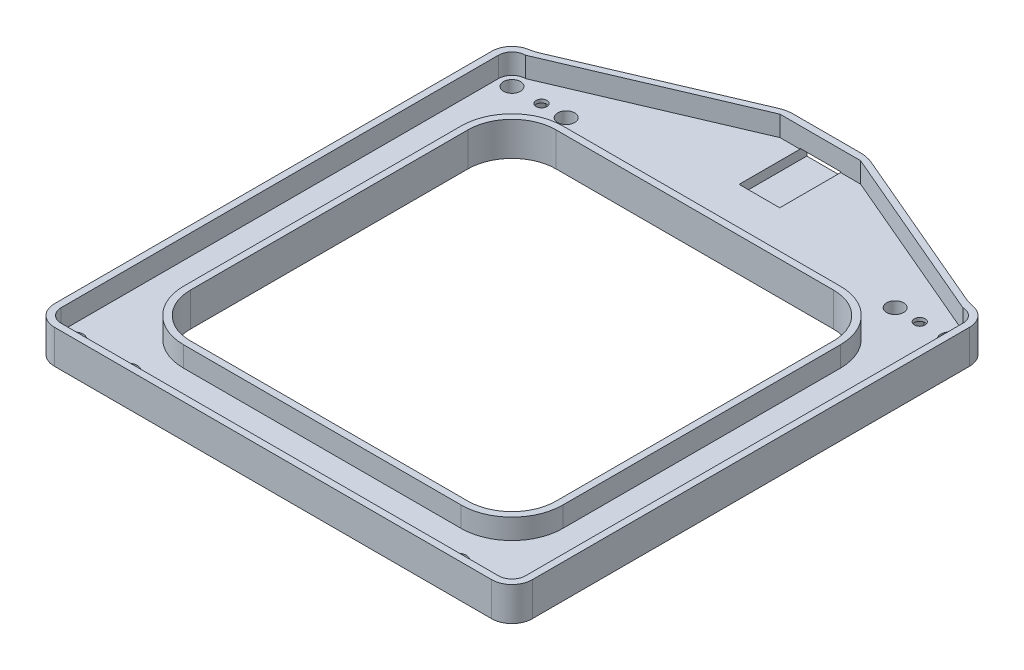
from build123d import *

# Parameters (mm, degrees)
BOSS_EXTRUDE1_DEPTH = 10
CUT_EXTRUDE1_DEPTH  = 6
SKETCH3_R           = 2.5
SKETCH3_R_2         = 1.6
CUT_EXTRUDE5_DEPTH  = 118.268793803
CUT_EXTRUDE6_DEPTH  = 3
FILLET1_R           = 10
SKETCH7_W           = 12
SKETCH7_H           = 3
CUT_EXTRUDE7_DEPTH  = 20


with BuildPart() as part:
    # Sketch1 → Boss-Extrude1 (new body)
    with BuildSketch(Plane(origin=(0, 0, 0), x_dir=(1, 0, 0), z_dir=(0, 1, 0))):
        with BuildLine():
            Line((-64.6, 70.6), (-13.781138102, 92.296857547))
            ThreePointArc((-13.781138102, 92.296857547), (-11.858510235, 92.897157125), (-9.854586018, 93.1))
            Line((-9.854586018, 93.1), (9.854586018, 93.1))
            ThreePointArc((9.854586018, 93.1), (11.858510235, 92.897157125), (13.781138102, 92.296857547))
            Line((13.781138102, 92.296857547), (64.6, 70.6))
            ThreePointArc((64.6, 70.6), (68.842640687, 68.842640687), (70.6, 64.6))
            Line((70.6, 64.6), (70.6, -64.6))
            ThreePointArc((70.6, -64.6), (68.842640687, -68.842640687), (64.6, -70.6))
            Line((64.6, -70.6), (-64.6, -70.6))
            ThreePointArc((-64.6, -70.6), (-68.842640687, -68.842640687), (-70.6, -64.6))
            Line((-70.6, -64.6), (-70.6, 64.6))
            ThreePointArc((-70.6, 64.6), (-68.842640687, 68.842640687), (-64.6, 70.6))
        make_face()
        with BuildLine():
            Line((-41, -54), (41, -54))
            ThreePointArc((41, -54), (50.192388155, -50.192388155), (54, -41))
            Line((54, -41), (54, 41))
            ThreePointArc((54, 41), (50.192388155, 50.192388155), (41, 54))
            Line((41, 54), (-41, 54))
            ThreePointArc((-41, 54), (-50.192388155, 50.192388155), (-54, 41))
            Line((-54, 41), (-54, -41))
            ThreePointArc((-54, -41), (-50.192388155, -50.192388155), (-41, -54))
        make_face(mode=Mode.SUBTRACT)
    extrude(amount=BOSS_EXTRUDE1_DEPTH)

    # Sketch2 → Cut-Extrude1 (cut)
    with BuildSketch(Plane(origin=(0, 10, 0), x_dir=(1, 0, 0), z_dir=(0, 1, 0))):
        with BuildLine():
            Line((-64.6, 68.6), (-11.9, 91.1))
            Line((-11.9, 91.1), (11.9, 91.1))
            Line((11.9, 91.1), (64.6, 68.6))
            ThreePointArc((64.6, 68.6), (67.428427125, 67.428427125), (68.6, 64.6))
            Line((68.6, 64.6), (68.6, -64.6))
            ThreePointArc((68.6, -64.6), (67.428427125, -67.428427125), (64.6, -68.6))
            Line((64.6, -68.6), (-64.6, -68.6))
            ThreePointArc((-64.6, -68.6), (-67.428427125, -67.428427125), (-68.6, -64.6))
            Line((-68.6, -64.6), (-68.6, 64.6))
            ThreePointArc((-68.6, 64.6), (-67.428427125, 67.428427125), (-64.6, 68.6))
        make_face()
        with BuildLine():
            Line((-41, -56), (41, -56))
            ThreePointArc((41, -56), (51.606601718, -51.606601718), (56, -41))
            Line((56, -41), (56, 41))
            ThreePointArc((56, 41), (51.606601718, 51.606601718), (41, 56))
            Line((41, 56), (-41, 56))
            ThreePointArc((-41, 56), (-51.606601718, 51.606601718), (-56, 41))
            Line((-56, 41), (-56, -41))
            ThreePointArc((-56, -41), (-51.606601718, -51.606601718), (-41, -56))
        make_face(mode=Mode.SUBTRACT)
    extrude(amount=-CUT_EXTRUDE1_DEPTH, mode=Mode.SUBTRACT)

    # Sketch3 → Cut-Extrude5 (cut, through all)
    with BuildSketch(Plane(origin=(0, 0, 0), x_dir=(1, 0, 0), z_dir=(0, 1, 0))):
        with Locations(Location((-64.6, 64.6, 0), (0, 0, 270))):
            Circle(SKETCH3_R)
        with Locations(Location((-48.6, 64.6, 0), (0, 0, 270))):
            Circle(SKETCH3_R)
        with Locations(Location((-55.87, 64.6, 0), (0, 0, 270))):
            Circle(SKETCH3_R_2)
        with Locations(Location((55.87, 64.6, 0), (0, 0, 90))):
            Circle(SKETCH3_R_2)
        with Locations(Location((48.6, 64.6, 0), (0, 0, 90))):
            Circle(SKETCH3_R)
        with Locations(Location((64.6, 64.6, 0), (0, 0, 90))):
            Circle(SKETCH3_R)
        with Locations(Location((64.6, -64.6, 0), (0, 0, 270))):
            Circle(SKETCH3_R)
        with Locations(Location((48.6, -64.6, 0), (0, 0, 270))):
            Circle(SKETCH3_R)
        with Locations(Location((55.87, -64.6, 0), (0, 0, 270))):
            Circle(SKETCH3_R_2)
        with Locations(Location((-55.87, -64.6, 0), (0, 0, 90))):
            Circle(SKETCH3_R_2)
        with Locations(Location((-48.6, -64.6, 0), (0, 0, 90))):
            Circle(SKETCH3_R)
        with Locations(Location((-64.6, -64.6, 0), (0, 0, 90))):
            Circle(SKETCH3_R)
    extrude(amount=CUT_EXTRUDE5_DEPTH, mode=Mode.SUBTRACT)

    # Sketch6 → Cut-Extrude6 (cut)
    with BuildSketch(Plane.XZ):
        Polygon((-52.405898385, 64.6), (-54.137949192, 67.6), (-57.602050808, 67.6), (-59.334101615, 64.6), (-57.602050808, 61.6), (-54.137949192, 61.6), align=None)
        Polygon((-54.137949192, -61.6), (-52.405898385, -64.6), (-54.137949192, -67.6), (-57.602050808, -67.6), (-59.334101615, -64.6), (-57.602050808, -61.6), align=None)
        Polygon((52.405898385, -64.6), (54.137949192, -67.6), (57.602050808, -67.6), (59.334101615, -64.6), (57.602050808, -61.6), (54.137949192, -61.6), align=None)
        Polygon((54.137949192, 61.6), (52.405898385, 64.6), (54.137949192, 67.6), (57.602050808, 67.6), (59.334101615, 64.6), (57.602050808, 61.6), align=None)
    extrude(amount=-CUT_EXTRUDE6_DEPTH, mode=Mode.SUBTRACT)

    # Fillet1
    fillet1_edges = [part.edges().sort_by_distance(p)[0] for p in [
        (-64.6, 5, -70.6),
        (64.6, 5, -70.6),
    ]]
    fillet(fillet1_edges, radius=FILLET1_R)

    # Sketch7 → Cut-Extrude7 (cut)
    with BuildSketch(Plane(origin=(0, 0, -93.1), x_dir=(-1, 0, 0), z_dir=(0, 0, -1))):
        with Locations((0, 2.73)):
            Rectangle(SKETCH7_W, SKETCH7_H)
    extrude(amount=-CUT_EXTRUDE7_DEPTH, mode=Mode.SUBTRACT)


solid = part.part
